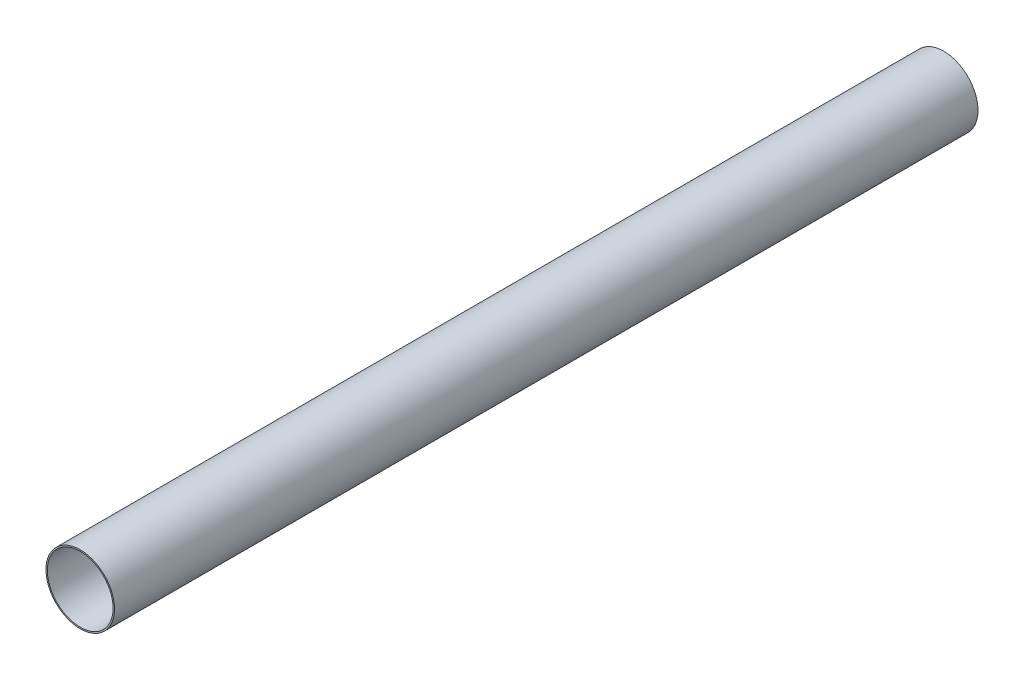
from build123d import *

# Parameters (mm, degrees)
SKETCH1_R           = 75
SKETCH1_R_2         = 72
BOSS_EXTRUDE1_DEPTH = 1891.221973386


with BuildPart() as part:
    # Sketch1 → Boss-Extrude1 (new body)
    with BuildSketch(Plane.XY):
        with Locations(Location((0, 0, 0), (0, 0, 90))):
            Circle(SKETCH1_R)
        with Locations(Location((0, 0, 0), (0, 0, 90))):
            Circle(SKETCH1_R_2, mode=Mode.SUBTRACT)
    extrude(amount=BOSS_EXTRUDE1_DEPTH)


solid = part.part
